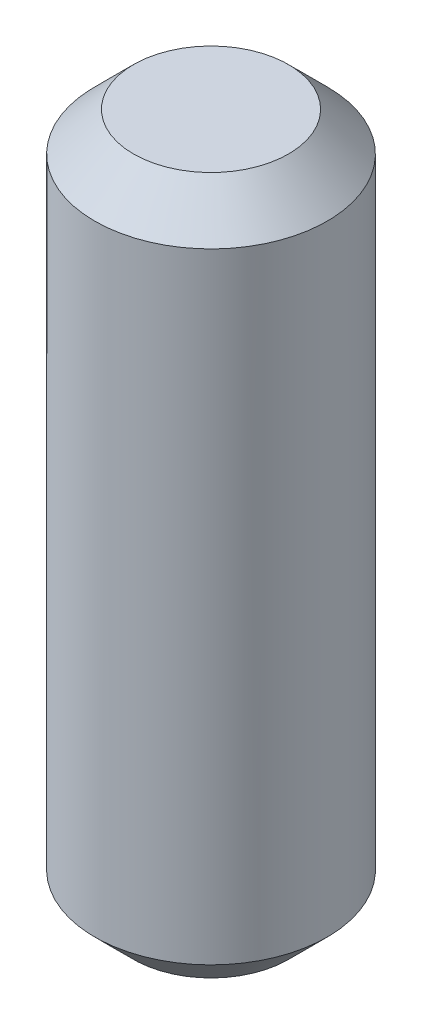
from build123d import *

# Parameters (mm, degrees)
SKETCH1_W     = 1.5
SKETCH1_H     = 9
CHAMFER1_SIZE = 0.5


with BuildPart() as part:
    # Sketch1 → Revolve1 (revolve)
    with BuildSketch(Plane.XY, mode=Mode.PRIVATE) as revolve1_sk:
        with Locations((0.75, 4.5)):
            Rectangle(SKETCH1_W, SKETCH1_H)
    revolve(revolve1_sk.sketch.rotate(Axis((0, 0, 0), (0, 1, 0)), 90), axis=Axis((0, 0, 0), (0, 1, 0)))

    # Chamfer1
    chamfer1_edges = [part.edges().sort_by_distance(p)[0] for p in [
        (0, 0, 1.5),
        (0, 9, 1.5),
    ]]
    chamfer(chamfer1_edges, length=CHAMFER1_SIZE)


solid = part.part
